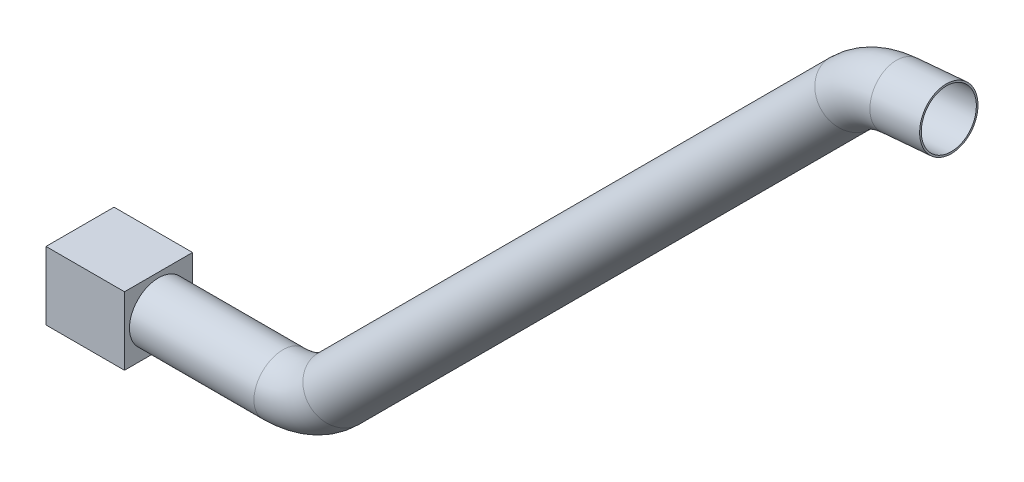
from build123d import *

# Parameters (mm, degrees)
BARRER2_PROFILE_R       = 55.5625
VACIADO1_T              = -3.175
CROQUIS2_W              = 130
CROQUIS2_H              = 130
SALIENTE_EXTRUIR1_DEPTH = 150


with BuildPart() as part:
    # Barrer2: sweep along a path in Croquis1
    with BuildLine(Plane.XY) as barrer2_path:
        Line((0, 0), (237.867965644, 0))
        ThreePointArc((237.867965644, 0), (295.270480499, 11.418070123), (343.933982822, 43.933982822))
        Line((343.933982822, 43.933982822), (1322.05529866, 1022.05529866))
        ThreePointArc((1322.05529866, 1022.05529866), (1364.728576577, 1051.935449537), (1415.047954426, 1065.418486196))
        Line((1415.047954426, 1065.418486196), (1510.089376494, 1073.733533192))
    # Barrer2 profile (on start of the path) → Barrer2 (sweep)
    with BuildSketch(Plane(origin=(0, 0, 0), x_dir=(0, 0, 1), z_dir=(1, 0, 0))):
        Circle(BARRER2_PROFILE_R)
    sweep(path=barrer2_path.line)

    # Vaciado1
    vaciado1_openings = [part.faces().sort_by_distance(p)[0] for p in [
        (1510.089376494, 1073.733533192, 0),
    ]]
    offset(amount=VACIADO1_T, openings=vaciado1_openings, kind=Kind.INTERSECTION)

    # Croquis2 → Saliente-Extruir1 (add)
    with BuildSketch(Plane.ZY):
        Rectangle(CROQUIS2_W, CROQUIS2_H)
    extrude(amount=SALIENTE_EXTRUIR1_DEPTH)


solid = part.part
